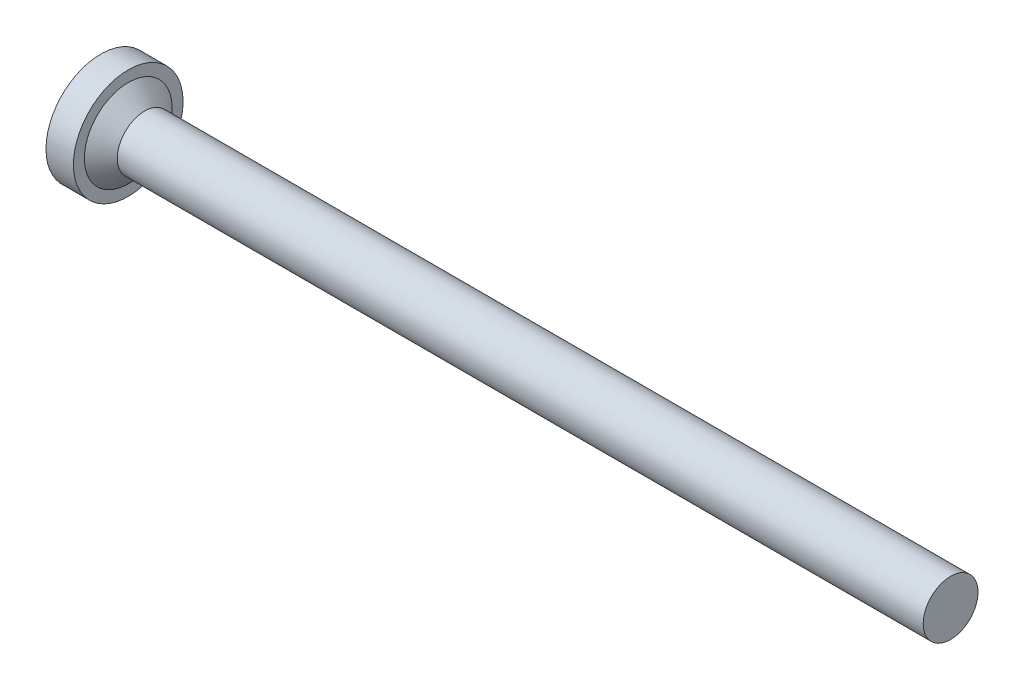
from build123d import *

# Parameters (mm, degrees)
SKETCH_1_R      = 5
EXTRUDE_1_DEPTH = 150
SKETCH_2_R      = 10
EXTRUDE_2_DEPTH = 5
CHAMFER_1_SIZE  = 3


with BuildPart() as part:
    # 草图1 → 凸台-拉伸1 (new body)
    with BuildSketch(Plane(origin=(0, 0, 0), x_dir=(0, 0, -1), z_dir=(1, 0, 0))):
        Circle(SKETCH_1_R)
    extrude(amount=EXTRUDE_1_DEPTH)

    # 草图2 → 凸台-拉伸2 (add)
    with BuildSketch(Plane.ZY):
        Circle(SKETCH_2_R)
    extrude(amount=EXTRUDE_2_DEPTH)

    # 倒角1
    chamfer_1_edges = [part.edges().sort_by_distance(p)[0] for p in [
        (0, 0, 5),
    ]]
    chamfer(chamfer_1_edges, length=CHAMFER_1_SIZE)


solid = part.part
